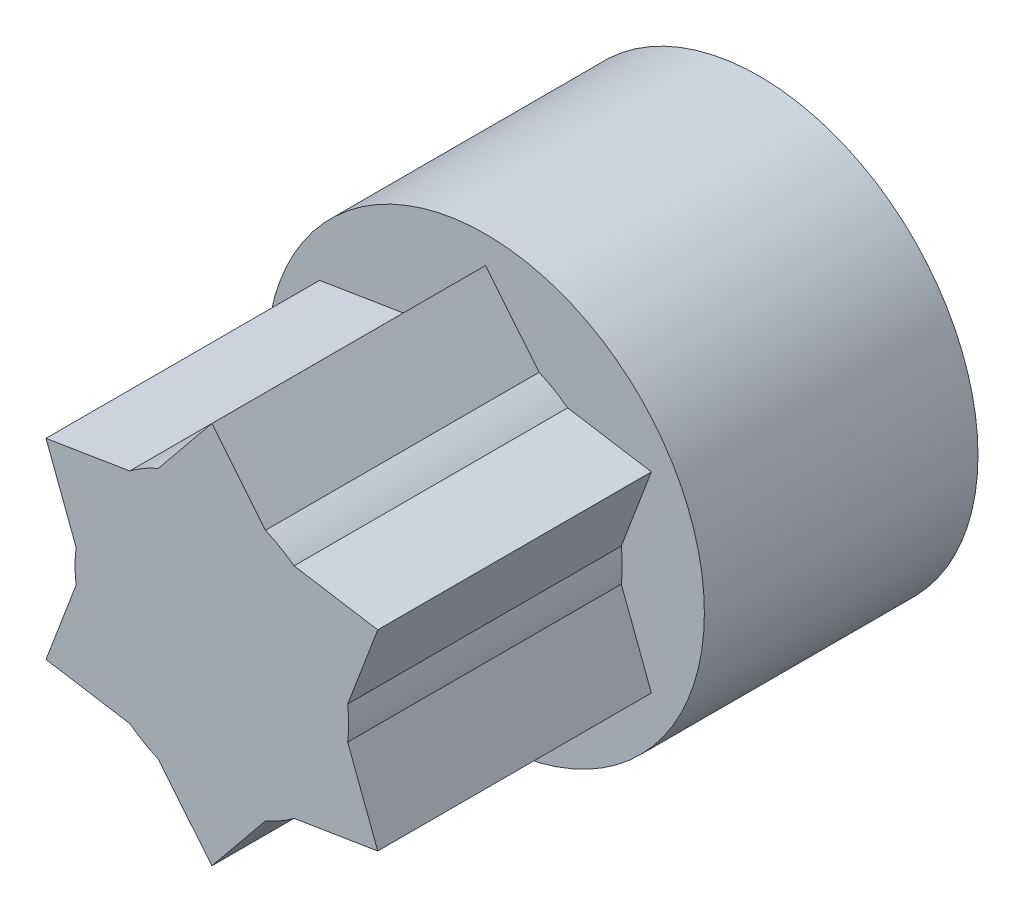
from build123d import *

# Parameters (mm, degrees)
SKETCH_2_R      = 2.5
EXTRUDE_2_DEPTH = 5
SKETCH_3_R      = 4
EXTRUDE_4_DEPTH = 5


with BuildPart() as part:
    # Эскиз2 → Бобышка-Вытянуть2 (new body)
    with BuildSketch(Plane.XY.offset(31.602998)):
        with BuildLine():
            Line((0, 3.5), (-0.979795897, 2.3))
            ThreePointArc((-0.979795897, 2.3), (0, 2.5), (0.979795897, 2.3))
            Line((0.979795897, 2.3), (0, 3.5))
        make_face()
        with BuildLine():
            Line((3.031088913, 1.75), (1.50196048, 1.998528137))
            ThreePointArc((1.50196048, 1.998528137), (2.165063509, 1.25), (2.481756377, 0.301471863))
            Line((2.481756377, 0.301471863), (3.031088913, 1.75))
        make_face()
        with BuildLine():
            Line((3.031088913, -1.75), (2.481756377, -0.301471863))
            ThreePointArc((2.481756377, -0.301471863), (2.165063509, -1.25), (1.50196048, -1.998528137))
            Line((1.50196048, -1.998528137), (3.031088913, -1.75))
        make_face()
        with BuildLine():
            ThreePointArc((0.979795897, -2.3), (0, -2.5), (-0.979795897, -2.3))
            Line((-0.979795897, -2.3), (0, -3.5))
            Line((0, -3.5), (0.979795897, -2.3))
        make_face()
        with BuildLine():
            ThreePointArc((-2.481756377, 0.301471863), (-2.165063509, 1.25), (-1.50196048, 1.998528137))
            Line((-1.50196048, 1.998528137), (-3.031088913, 1.75))
            Line((-3.031088913, 1.75), (-2.481756377, 0.301471863))
        make_face()
        with BuildLine():
            ThreePointArc((-1.50196048, -1.998528137), (-2.165063509, -1.25), (-2.481756377, -0.301471863))
            Line((-2.481756377, -0.301471863), (-3.031088913, -1.75))
            Line((-3.031088913, -1.75), (-1.50196048, -1.998528137))
        make_face()
        Circle(SKETCH_2_R)
    extrude(amount=EXTRUDE_2_DEPTH)

    # Эскиз3 → Бобышка-Вытянуть4 (add)
    with BuildSketch(Plane.XY.offset(31.602998)):
        Circle(SKETCH_3_R)
    extrude(amount=-EXTRUDE_4_DEPTH)


solid = part.part
